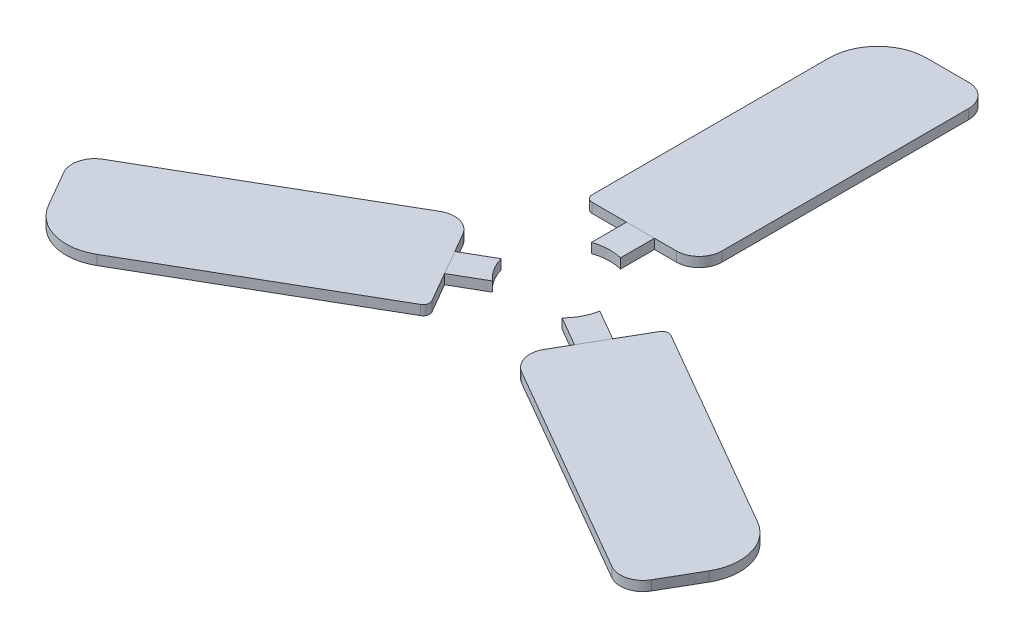
from build123d import *

# Parameters (mm, degrees)
BOSS_EXTRUDE1_DEPTH = 30
SKETCH2_R           = 150.200555771
BOSS_EXTRUDE2_DEPTH = 30
CIRPATTERN2_COUNT   = 3
BOSS_EXTRUDE4_DEPTH = 30
CIRPATTERN3_COUNT   = 3
SKETCH4_R           = 150.200555771
CUT_EXTRUDE1_DEPTH  = 30


with BuildPart() as part:
    # Sketch1 → Boss-Extrude1 (new body)
    with BuildSketch(Plane(origin=(0, 0, 0), x_dir=(1, 0, 0), z_dir=(0, 1, 0))):
        with BuildLine():
            Line((0, 0), (-105.994049605, 0))
            ThreePointArc((-105.994049605, 0), (-120.136185229, 5.857864376), (-125.994049605, 20))
            Line((-125.994049605, 20), (-125.994049605, 750))
            ThreePointArc((-125.994049605, 750), (-82.060066783, 856.066017178), (24.005950395, 900))
            Line((24.005950395, 900), (154.005950395, 900))
            ThreePointArc((154.005950395, 900), (203.503425078, 879.497474683), (224.005950395, 830))
            Line((224.005950395, 830), (224.005950395, 70))
            ThreePointArc((224.005950395, 70), (203.503425078, 20.502525317), (154.005950395, 0))
            Line((154.005950395, 0), (0, 0))
        make_face()
    extrude(amount=BOSS_EXTRUDE1_DEPTH)


with BuildPart() as body_2:
    # Sketch2 → Boss-Extrude2 (new body)
    with BuildSketch(Plane(origin=(0, 0, 0), x_dir=(1, 0, 0), z_dir=(0, 1, 0))):
        with Locations(Location((49.005950395, -250, 0), (0, 0, 270))):
            Circle(SKETCH2_R)
    extrude(amount=BOSS_EXTRUDE2_DEPTH)

    # Sketch4 → Cut-Extrude1 (cut)
    with BuildSketch(Plane(origin=(0, 30, 0), x_dir=(1, 0, 0), z_dir=(0, 1, 0))):
        with Locations((49.005950395, -250)):
            Circle(SKETCH4_R)
    extrude(amount=-CUT_EXTRUDE1_DEPTH, mode=Mode.SUBTRACT)


with BuildPart() as cirpattern2_1:
    # CirPattern2: pattern copy
    add(part.part.rotate(Axis((49.005950395, 0, 250), (0, 1, 0)), 1 * 360 / CIRPATTERN2_COUNT))


with BuildPart() as cirpattern2_2:
    # CirPattern2: pattern copy
    add(part.part.rotate(Axis((49.005950395, 0, 250), (0, 1, 0)), 2 * 360 / CIRPATTERN2_COUNT))


with BuildPart() as body_5:
    # Sketch3 → Boss-Extrude4 (new body)
    with BuildSketch(Plane(origin=(0, 30, 0), x_dir=(1, 0, 0), z_dir=(0, 1, 0))):
        with BuildLine():
            Line((0, -108.018931615), (0, 0))
            Line((0, 0), (86.073824667, 0))
            Line((86.073824667, 0), (86.073824667, -104.445269225))
            ThreePointArc((86.073824667, -104.445269225), (42.775205568, -99.928734353), (0, -108.018931615))
        make_face()
    extrude(amount=-BOSS_EXTRUDE4_DEPTH)


with BuildPart() as cirpattern3_1:
    # CirPattern3: pattern copy
    add(body_5.part.rotate(Axis((49.005950395, 0, 250), (0, 1, 0)), 1 * 360 / CIRPATTERN3_COUNT))


with BuildPart() as cirpattern3_2:
    # CirPattern3: pattern copy
    add(body_5.part.rotate(Axis((49.005950395, 0, 250), (0, 1, 0)), 2 * 360 / CIRPATTERN3_COUNT))


solid = Compound([part.part, cirpattern2_1.part, cirpattern2_2.part, body_5.part, cirpattern3_1.part, cirpattern3_2.part])
